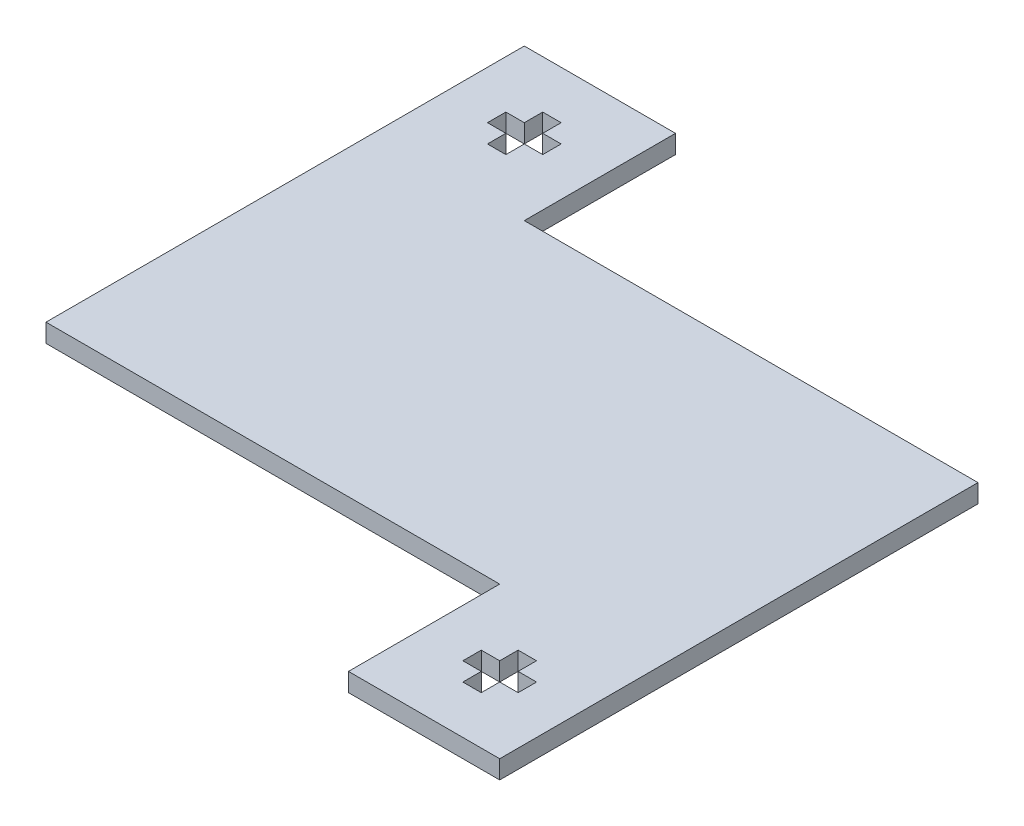
from build123d import *

# Parameters (mm, degrees)
BOSS_EXTRUDE1_DEPTH = 5.08


with BuildPart() as part:
    # Sketch1 → Boss-Extrude1 (new body)
    with BuildSketch(Plane(origin=(0, 0, 0), x_dir=(1, 0, 0), z_dir=(0, 1, 0))):
        Polygon((-36.363267323, 33.553843074), (88.708872677, 33.553843074), (88.708872677, -56.605996926), (88.708872677, -98.295016926), (47.014772677, -98.295016926), (47.014772677, -56.605996926), (-78.052287323, -56.605996926), (-78.052287323, 33.553843074), (-78.052287323, 75.242863074), (-36.363267323, 75.242863074), align=None)
        Polygon((-57.207777323, 62.018353074), (-54.667777323, 62.018353074), (-54.667777323, 56.938353074), (-49.587777323, 56.938353074), (-49.587777323, 54.398353074), (-49.587777323, 51.858353074), (-54.667777323, 51.858353074), (-54.667777323, 46.778353074), (-57.207777323, 46.778353074), (-59.747777323, 46.778353074), (-59.747777323, 51.858353074), (-64.827777323, 51.858353074), (-64.827777323, 54.398353074), (-64.827777323, 56.938353074), (-59.747777323, 56.938353074), (-59.747777323, 62.018353074), align=None, mode=Mode.SUBTRACT)
        Polygon((60.241822677, -77.450506926), (60.241822677, -74.910506926), (65.321822677, -74.910506926), (65.321822677, -69.830506926), (67.861822677, -69.830506926), (70.401822677, -69.830506926), (70.401822677, -74.910506926), (75.481822677, -74.910506926), (75.481822677, -77.450506926), (75.481822677, -79.990506926), (70.401822677, -79.990506926), (70.401822677, -85.070506926), (67.861822677, -85.070506926), (65.321822677, -85.070506926), (65.321822677, -79.990506926), (60.241822677, -79.990506926), align=None, mode=Mode.SUBTRACT)
    extrude(amount=BOSS_EXTRUDE1_DEPTH)


solid = part.part
